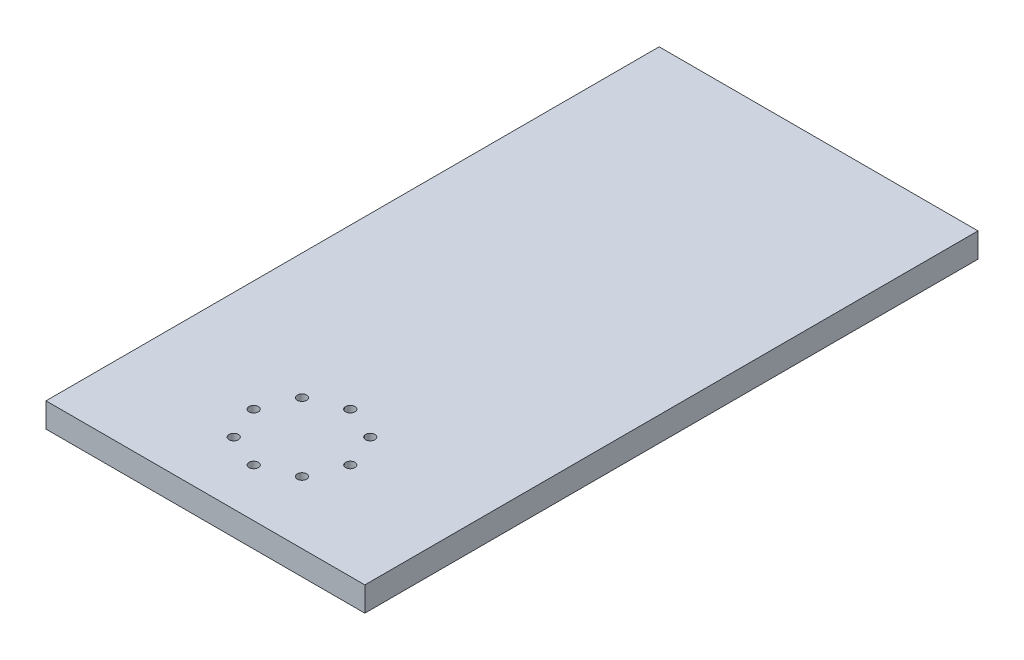
from build123d import *

# Parameters (mm, degrees)
SKETCH1_W           = 254
SKETCH1_H           = 355.6
BASE_EXTRUDE_DEPTH  = 12.7
SKETCH6_OUTSIDE_W   = 343.436
SKETCH6_OUTSIDE_H   = 445.036
SKETCH6_OUTSIDE_W_2 = 165.1
SKETCH6_OUTSIDE_H_2 = 317.5
CUT_TO_SIZE_DEPTH   = 219.867836833
SKETCH12_R          = 2.413
CUT_EXTRUDE3_DEPTH  = 204.464345771


with BuildPart() as part:
    # Sketch1 → Base_extrude (new body)
    with BuildSketch(Plane(origin=(0, 0, 0), x_dir=(1, 0, 0), z_dir=(0, 1, 0))):
        Rectangle(SKETCH1_W, SKETCH1_H)
    extrude(amount=BASE_EXTRUDE_DEPTH)

    # Sketch6 outside → Cut_to_size (cut, through all)
    with BuildSketch(Plane(origin=(0, 12.7, 0), x_dir=(1, 0, 0), z_dir=(0, 1, 0))):
        Rectangle(SKETCH6_OUTSIDE_W, SKETCH6_OUTSIDE_H)
        with Locations((15.55, 19.05)):
            Rectangle(SKETCH6_OUTSIDE_W_2, SKETCH6_OUTSIDE_H_2, mode=Mode.SUBTRACT)
    extrude(amount=-CUT_TO_SIZE_DEPTH, mode=Mode.SUBTRACT)

    # Sketch12 → Cut-Extrude3 (cut, through all)
    with BuildSketch(Plane(origin=(0, 12.7, 0), x_dir=(1, 0, 0), z_dir=(0, 1, 0))):
        with Locations(Location((33.22766953, -107.37766953, 0), (0, 0, 270))):
            Circle(SKETCH12_R)
        with Locations(Location((40.55, -89.7, 0), (0, 0, 270))):
            Circle(SKETCH12_R)
        with Locations(Location((33.22766953, -72.02233047, 0), (0, 0, 270))):
            Circle(SKETCH12_R)
        with Locations(Location((15.55, -64.7, 0), (0, 0, 270))):
            Circle(SKETCH12_R)
        with Locations(Location((-2.12766953, -72.02233047, 0), (0, 0, 270))):
            Circle(SKETCH12_R)
        with Locations(Location((-9.45, -89.7, 0), (0, 0, 270))):
            Circle(SKETCH12_R)
        with Locations(Location((-2.12766953, -107.37766953, 0), (0, 0, 270))):
            Circle(SKETCH12_R)
        with Locations(Location((15.55, -114.7, 0), (0, 0, 270))):
            Circle(SKETCH12_R)
    extrude(amount=-CUT_EXTRUDE3_DEPTH, mode=Mode.SUBTRACT)


solid = part.part
